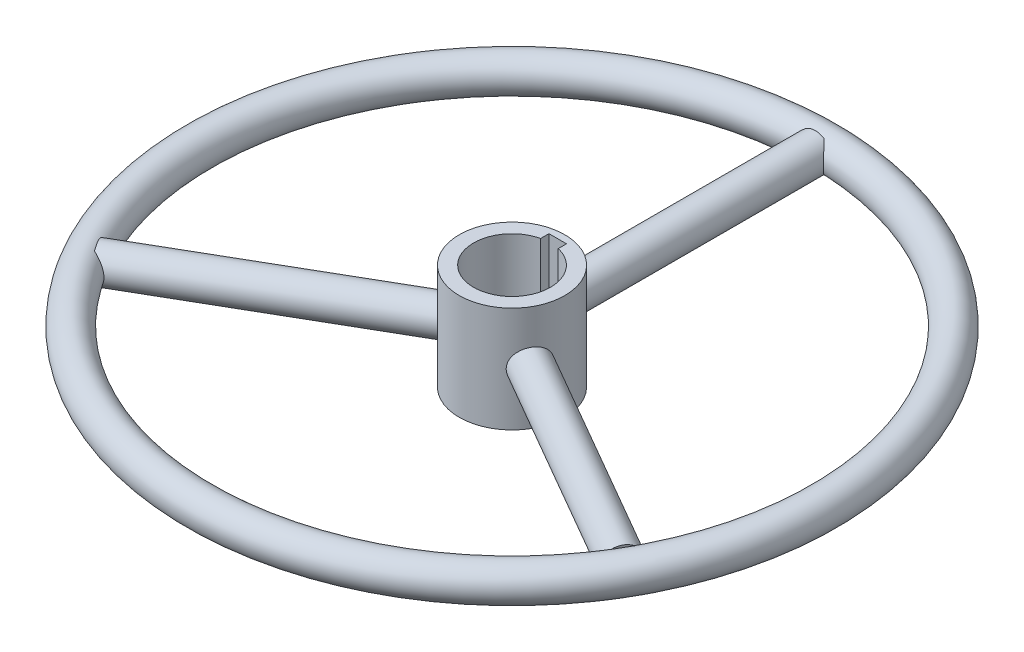
from build123d import *

# Parameters (mm, degrees)
SKETCH1_R                = 8
BOSS_EXTRUDE1_DEPTH      = 24
BOSS_EXTRUDE1_DEPTH_BACK = 24
SKETCH2_R                = 24
SKETCH2_R_2              = 17.5
SKETCH3_R                = 8
BOSS_EXTRUDE4_DEPTH      = 117
CIRPATTERN1_COUNT        = 3
SKETCH4_W                = 8
SKETCH4_H                = 23.550074586
CUT_EXTRUDE1_DEPTH       = 105


with BuildPart() as part:
    # Sketch1 → Revolve1 (revolve)
    with BuildSketch(Plane.XY, mode=Mode.PRIVATE) as revolve1_sk:
        with Locations((142, 0)):
            Circle(SKETCH1_R)
    revolve(revolve1_sk.sketch.rotate(Axis((0, 0, 0), (0, -1, 0)), 90), axis=Axis((0, 0, 0), (0, -1, 0)))

    # Sketch3 → Boss-Extrude4 (add)
    with BuildSketch(Plane.XY.offset(-21)):
        Circle(SKETCH3_R)
    boss_extrude4 = extrude(amount=-BOSS_EXTRUDE4_DEPTH)

    # CirPattern1: Boss-Extrude4 ×3 about axis
    cirpattern1_axis = Axis((0, 0, 0), (0, 1, 0))
    for i in range(1, CIRPATTERN1_COUNT):
        add(boss_extrude4.rotate(cirpattern1_axis, i * 360 / CIRPATTERN1_COUNT))


with BuildPart() as body_2:
    # Sketch2 → Boss-Extrude1 (new, two sides: drawn at the far end of the back side and taken through both)
    with BuildSketch(Plane(origin=(0, 0, 0), x_dir=(1, 0, 0), z_dir=(0, 1, 0)).offset(-BOSS_EXTRUDE1_DEPTH_BACK)):
        with Locations(Location((0, 0, 0), (0, 0, 270))):
            Circle(SKETCH2_R)
        with Locations(Location((0, 0, 0), (0, 0, 270))):
            Circle(SKETCH2_R_2, mode=Mode.SUBTRACT)
    extrude(amount=BOSS_EXTRUDE1_DEPTH + BOSS_EXTRUDE1_DEPTH_BACK)

    # Sketch4 → Cut-Extrude1 (cut)
    with BuildSketch(Plane(origin=(0, 24, 0), x_dir=(1, 0, 0), z_dir=(0, 1, 0))):
        with Locations((0, 9.024962707)):
            Rectangle(SKETCH4_W, SKETCH4_H)
    extrude(amount=-CUT_EXTRUDE1_DEPTH, mode=Mode.SUBTRACT)


solid = Compound([part.part, body_2.part])
